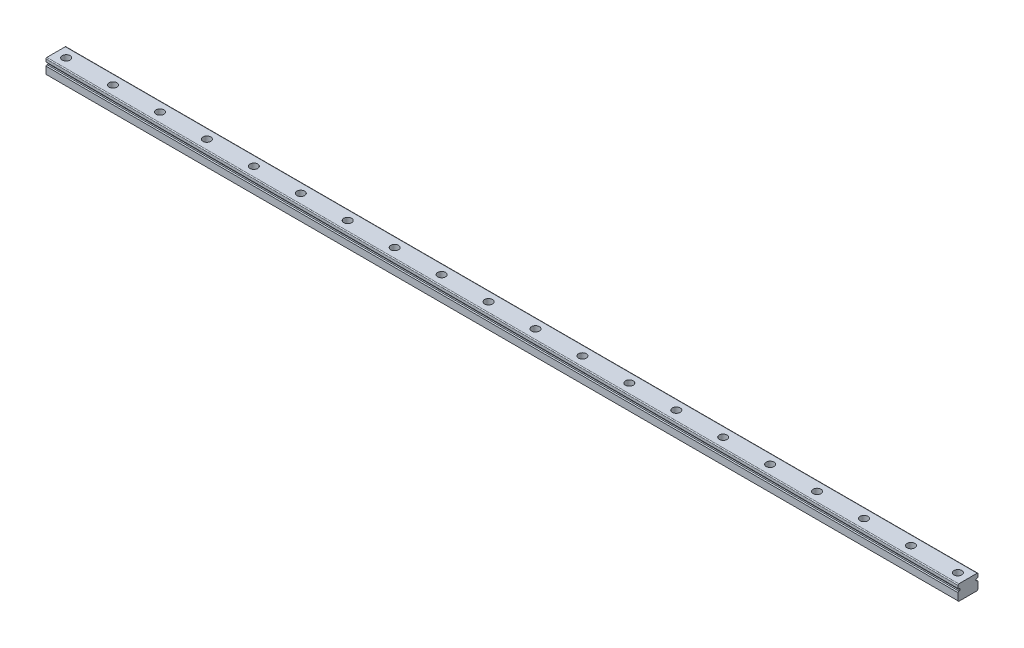
from build123d import *

# Parameters (mm, degrees)
EXTRUDE_1_DEPTH        = 2040
SKETCH_2_R             = 8.75
CUT_EXTRUDE_1_DEPTH    = 14
CUT_EXTRUDE_2_REACH    = 2042.407
SKETCH_3_R             = 5.5
PATTERN_LINEAR_1_COUNT = 20
PATTERN_LINEAR_1_PITCH = 105


with BuildPart() as part:
    # 草图1 → 凸台-拉伸1 (new body)
    with BuildSketch(Plane(origin=(0, 0, 0), x_dir=(0, 0, -1), z_dir=(1, 0, 0))):
        with BuildLine():
            Line((-20.5, 0), (20.5, 0))
            Line((20.5, 0), (22.5, 2))
            Line((22.5, 2), (22.5, 18))
            Line((22.5, 18), (20.5, 20))
            Line((20.5, 20), (17.5, 20))
            Line((17.5, 20), (17.5, 24))
            Line((17.5, 24), (20.5, 24))
            Line((20.5, 24), (22.5, 26))
            Line((22.5, 26), (22.5, 32))
            ThreePointArc((22.5, 32), (21.914213562, 33.414213562), (20.5, 34))
            Line((20.5, 34), (-20.5, 34))
            ThreePointArc((-20.5, 34), (-21.914213562, 33.414213562), (-22.5, 32))
            Line((-22.5, 32), (-22.5, 26))
            Line((-22.5, 26), (-20.5, 24))
            Line((-20.5, 24), (-17.5, 24))
            Line((-17.5, 24), (-17.5, 20))
            Line((-17.5, 20), (-20.5, 20))
            Line((-20.5, 20), (-22.5, 18))
            Line((-22.5, 18), (-22.5, 2))
            Line((-22.5, 2), (-20.5, 0))
        make_face()
    extrude(amount=EXTRUDE_1_DEPTH)

    # 草图2 → 切除-拉伸1 (cut)
    with BuildSketch(Plane(origin=(0, 34, 0), x_dir=(1, 0, 0), z_dir=(0, 1, 0))):
        with Locations(Location((22.5, 0, 0), (0, 0, 270))):
            Circle(SKETCH_2_R)
    cut_extrude_1 = extrude(amount=-CUT_EXTRUDE_1_DEPTH, mode=Mode.SUBTRACT)

    # 草图3 → 切除-拉伸2 (cut, up to next)
    with BuildSketch(Plane.XZ, mode=Mode.PRIVATE) as cut_extrude_2_sk1:
        with Locations(Location((22.5, 0, 0), (0, 0, 270))):
            Circle(SKETCH_3_R)
    cut_extrude_2_tool1 = extrude(cut_extrude_2_sk1.sketch, amount=-CUT_EXTRUDE_2_REACH, mode=Mode.PRIVATE) & part.part
    cut_extrude_2 = cut_extrude_2_tool1.solids().sort_by_distance((22.5, 0, 0))[0]
    add(cut_extrude_2, mode=Mode.SUBTRACT)

    # 阵列(线性)1: 切除-拉伸1, 切除-拉伸2 ×20
    with Locations(*[(i * PATTERN_LINEAR_1_PITCH, 0, 0) for i in range(1, PATTERN_LINEAR_1_COUNT)]):
        add(cut_extrude_1, mode=Mode.SUBTRACT)
        add(cut_extrude_2, mode=Mode.SUBTRACT)


solid = part.part
